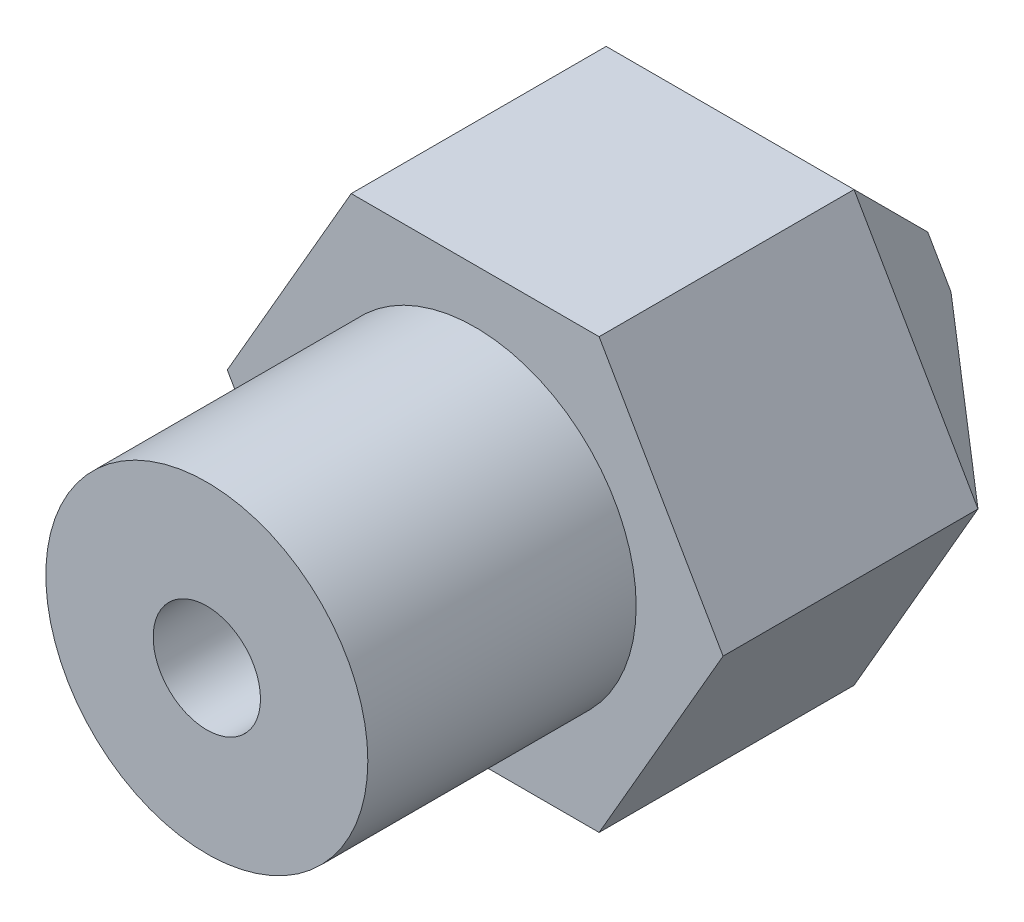
from build123d import *

# Parameters (mm, degrees)
BOSS_EXTRU_1_DEPTH                  = 13
ESQUISSE2_W                         = 18.874173297
ESQUISSE2_H                         = 12.028484965
ESQUISSE2_R                         = 3
ENL_V_MAT_EXTRU_1_DEPTH             = 5
CHANFREIN1_SIZE                     = 3.25
DIAM_TRE_DU_PER_AGE_1_5_1_5_1_D     = 1.5
DIAM_TRE_DU_PER_AGE_1_5_1_5_1_DEPTH = 12.1
DIAM_TRE_DU_PER_AGE_1_5_1_5_1_TIP   = 0.450645464
DIAM_TRE_DU_PER_AGE_2_0_2_1_D       = 2
DIAM_TRE_DU_PER_AGE_2_0_2_1_DEPTH   = 10.6
DIAM_TRE_DU_PER_AGE_2_0_2_1_TIP     = 0.600860619
DIAM_TRE_DU_PER_AGE_0_4_0_4_1_D     = 0.4
DIAM_TRE_DU_PER_AGE_0_4_0_4_1_DEPTH = 1
DIAM_TRE_DU_PER_AGE_0_4_0_4_1_TIP   = 0.120172124


with BuildPart() as part:
    # Esquisse1 → Boss.-Extru.1 (new body)
    with BuildSketch(Plane.XY):
        Polygon((4.618802154, 0), (2.309401077, 4), (-2.309401077, 4), (-4.618802154, 0), (-2.309401077, -4), (2.309401077, -4), align=None)
    extrude(amount=BOSS_EXTRU_1_DEPTH)

    # Esquisse2 → Enlèv. mat.-Extru.1 (cut)
    with BuildSketch(Plane.XY.offset(13)):
        with Locations((-1.221770637, -0.072445614)):
            Rectangle(ESQUISSE2_W, ESQUISSE2_H)
        Circle(ESQUISSE2_R, mode=Mode.SUBTRACT)
    extrude(amount=-ENL_V_MAT_EXTRU_1_DEPTH, mode=Mode.SUBTRACT)

    # Chanfrein1
    chanfrein1_edges = [part.edges().sort_by_distance(p)[0] for p in [
        (0, -4, 0),
        (-3.464101615, -2, 0),
        (-3.464101615, 2, 0),
        (0, 4, 0),
        (3.464101615, 2, 0),
        (3.464101615, -2, 0),
    ]]
    chamfer(chanfrein1_edges, length=CHANFREIN1_SIZE)

    # Diamètre du perçage Ø1.5 (1.5)1
    with Locations(Plane.XY.offset(13)):
        with Locations((0, 0)):
            Hole(DIAM_TRE_DU_PER_AGE_1_5_1_5_1_D / 2, depth=DIAM_TRE_DU_PER_AGE_1_5_1_5_1_DEPTH)
            with Locations((0, 0, -(DIAM_TRE_DU_PER_AGE_1_5_1_5_1_DEPTH + DIAM_TRE_DU_PER_AGE_1_5_1_5_1_TIP / 2))):  # 118° drill point
                Cone(0, DIAM_TRE_DU_PER_AGE_1_5_1_5_1_D / 2, DIAM_TRE_DU_PER_AGE_1_5_1_5_1_TIP, mode=Mode.SUBTRACT)

    # Diamètre du perçage Ø2.0 (2)1
    with Locations(Plane.XY.offset(13)):
        with Locations((0, 0)):
            Hole(DIAM_TRE_DU_PER_AGE_2_0_2_1_D / 2, depth=DIAM_TRE_DU_PER_AGE_2_0_2_1_DEPTH)
            with Locations((0, 0, -(DIAM_TRE_DU_PER_AGE_2_0_2_1_DEPTH + DIAM_TRE_DU_PER_AGE_2_0_2_1_TIP / 2))):  # 118° drill point
                Cone(0, DIAM_TRE_DU_PER_AGE_2_0_2_1_D / 2, DIAM_TRE_DU_PER_AGE_2_0_2_1_TIP, mode=Mode.SUBTRACT)

    # Diamètre du perçage Ø0.4 (0.4)1
    with Locations(Plane(origin=(0, 0, 0), x_dir=(-1, 0, 0), z_dir=(0, 0, -1))):
        with Locations((0, 0)):
            Hole(DIAM_TRE_DU_PER_AGE_0_4_0_4_1_D / 2, depth=DIAM_TRE_DU_PER_AGE_0_4_0_4_1_DEPTH)
            with Locations((0, 0, -(DIAM_TRE_DU_PER_AGE_0_4_0_4_1_DEPTH + DIAM_TRE_DU_PER_AGE_0_4_0_4_1_TIP / 2))):  # 118° drill point
                Cone(0, DIAM_TRE_DU_PER_AGE_0_4_0_4_1_D / 2, DIAM_TRE_DU_PER_AGE_0_4_0_4_1_TIP, mode=Mode.SUBTRACT)


solid = part.part
